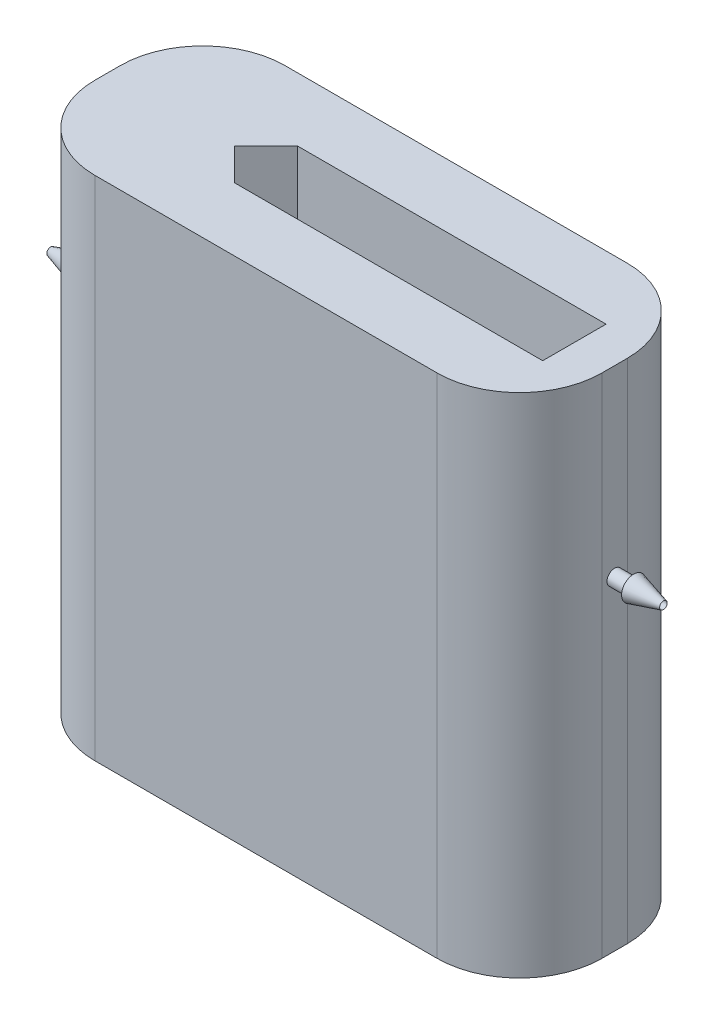
from build123d import *

# Parameters (mm, degrees)
SKETCH1_W               = 80
SKETCH1_H               = 30
BOSS_EXTRUDE1_DEPTH     = 80
CUT_EXTRUDE1_DEPTH      = 75
CUT_EXTRUDE2_DEPTH      = 115.127122105
CUT_EXTRUDE2_DEPTH_BACK = 115.127122105
SKETCH3_R               = 0.8
SKETCH4_R               = 1.5
SKETCH4_R_2             = 1.2
BOSS_EXTRUDE2_DEPTH     = 3
SKETCH7_R               = 0.6
CUT_EXTRUDE3_DEPTH      = 2
SKETCH8_R               = 0.8
CUT_EXTRUDE4_DEPTH      = 53
FILLET1_R               = 13
SKETCH9_R               = 1.2
SKETCH9_R_2             = 0.8
BOSS_EXTRUDE3_DEPTH     = 3
CUT_EXTRUDE5_START      = -2
SKETCH12_R              = 0.6
CUT_EXTRUDE5_DEPTH      = 2
CUT_EXTRUDE6_START      = -35
SKETCH14_R              = 0.8
CUT_EXTRUDE6_DEPTH      = 35


with BuildPart() as part:
    # Sketch1 → Boss-Extrude1 (new body)
    with BuildSketch(Plane(origin=(0, 0, 0), x_dir=(1, 0, 0), z_dir=(0, 1, 0))):
        Rectangle(SKETCH1_W, SKETCH1_H)
    extrude(amount=BOSS_EXTRUDE1_DEPTH)

    # Sketch2 → Cut-Extrude1 (cut)
    with BuildSketch(Plane(origin=(0, 80, 0), x_dir=(1, 0, 0), z_dir=(0, 1, 0))):
        Polygon((-15, 5), (15, 5), (33.657016573, 5), (33.657016573, -5), (15, -5), (-15, -5), (-20, 0), align=None)
    extrude(amount=-CUT_EXTRUDE1_DEPTH, mode=Mode.SUBTRACT)

    # Sketch3 → Cut-Extrude2 (cut, two sides: drawn at the far end of the back side and taken through both)
    with BuildSketch(Plane.ZY.offset(40).offset(-CUT_EXTRUDE2_DEPTH_BACK)):
        with Locations(Location((0, 51.111959895, 0), (0, 0, 270))):
            Circle(SKETCH3_R)
    extrude(amount=CUT_EXTRUDE2_DEPTH + CUT_EXTRUDE2_DEPTH_BACK, mode=Mode.SUBTRACT)

    # Sketch4 → Boss-Extrude2 (add)
    with BuildSketch(Plane.ZY.offset(40)):
        with Locations(Location((0, 51.111959895, 0), (0, 0, 180))):
            Circle(SKETCH4_R)
        with Locations((0, 51.111959895)):
            Circle(SKETCH4_R_2, mode=Mode.SUBTRACT)
    extrude(amount=BOSS_EXTRUDE2_DEPTH)

    # Sketch6 → Revolve1 (revolve)
    with BuildSketch(Plane.XY, mode=Mode.PRIVATE) as revolve1_sk:
        Polygon((-43, 51.111959895), (-49.325220868, 51.111959895), (-49.325220868, 51.611959895), (-43, 53.511959895), align=None)
    revolve(revolve1_sk.sketch.rotate(Axis((-43, 51.111959895, 0), (-1, 0, 0)), 270), axis=Axis((-43, 51.111959895, 0), (-1, 0, 0)))

    # Sketch7 → Cut-Extrude3 (cut)
    with BuildSketch(Plane.ZY.offset(49.325220868)):
        with Locations((0, 51.111959895)):
            Circle(SKETCH7_R)
    extrude(amount=-CUT_EXTRUDE3_DEPTH, mode=Mode.SUBTRACT)

    # Sketch8 → Cut-Extrude4 (cut)
    with BuildSketch(Plane.ZY.offset(47.325220868)):
        with Locations(Location((0, 51.111959895, 0), (0, 0, 270))):
            Circle(SKETCH8_R)
    extrude(amount=-CUT_EXTRUDE4_DEPTH, mode=Mode.SUBTRACT)

    # Fillet1
    fillet1_edges = [part.edges().sort_by_distance(p)[0] for p in [
        (40, 40, 15),
        (-40, 40, 15),
        (-40, 40, -15),
        (40, 40, -15),
    ]]
    fillet(fillet1_edges, radius=FILLET1_R)

    # Sketch9 → Boss-Extrude3 (add)
    with BuildSketch(Plane(origin=(40, 0, 0), x_dir=(0, 0, -1), z_dir=(1, 0, 0))):
        with Locations(Location((0, 51.111959895, 0), (0, 0, 180))):
            Circle(SKETCH9_R)
        with Locations(Location((0, 51.111959895, 0), (0, 0, 270))):
            Circle(SKETCH9_R_2, mode=Mode.SUBTRACT)
    extrude(amount=BOSS_EXTRUDE3_DEPTH)


with BuildPart() as body_2:
    # Sketch11 → Revolve2 (revolve)
    with BuildSketch(Plane.XY, mode=Mode.PRIVATE) as revolve2_sk:
        Polygon((43, 51.111959895), (43, 53.013316413), (47.705149283, 51.711959895), (47.705149283, 51.111959895), align=None)
    revolve(revolve2_sk.sketch.rotate(Axis((43, 51.111959895, 0), (1, 0, 0)), 270), axis=Axis((43, 51.111959895, 0), (1, 0, 0)))

    # Sketch12 → Cut-Extrude5 (cut)
    with BuildSketch(Plane(origin=(47.705149283, 0, 0), x_dir=(0, 0, -1), z_dir=(1, 0, 0)).offset(CUT_EXTRUDE5_START)):
        with Locations((0, 51.111959895)):
            Circle(SKETCH12_R)
    extrude(amount=CUT_EXTRUDE5_DEPTH, mode=Mode.SUBTRACT)

    # Sketch14 → Cut-Extrude6 (cut)
    with BuildSketch(Plane(origin=(45.705149283, 0, 0), x_dir=(0, 0, -1), z_dir=(1, 0, 0)).offset(CUT_EXTRUDE6_START)):
        with Locations((0, 51.111959895)):
            Circle(SKETCH14_R)
    extrude(amount=CUT_EXTRUDE6_DEPTH, mode=Mode.SUBTRACT)


solid = Compound([part.part, body_2.part])
